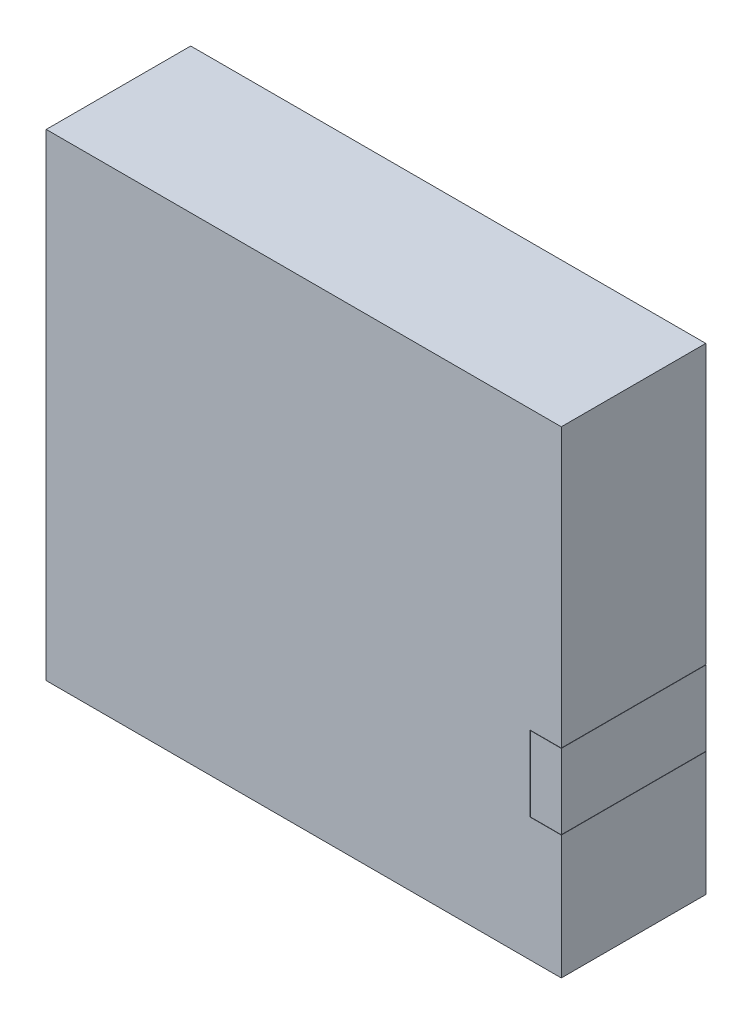
from build123d import *

# Parameters (mm, degrees)
SKETCH_1_W          = 82
SKETCH_1_H          = 76
EXTRUDE_1_DEPTH     = 23
SKETCH_2_W          = 5
SKETCH_2_H          = 12
CUT_EXTRUDE_1_DEPTH = 23
SKETCH_5_W          = 4.9
SKETCH_5_H          = 11.9
EXTRUDE_3_DEPTH     = 23


with BuildPart() as part:
    # 草图1 → 凸台-拉伸1 (new body)
    with BuildSketch(Plane.XY):
        with Locations((-0.551569507, -15.753363229)):
            Rectangle(SKETCH_1_W, SKETCH_1_H)
    extrude(amount=EXTRUDE_1_DEPTH)

    # 草图2 → 切除-拉伸1 (cut)
    with BuildSketch(Plane.XY.offset(23)):
        with Locations((37.948430493, -28.051693566)):
            Rectangle(SKETCH_2_W, SKETCH_2_H)
    extrude(amount=-CUT_EXTRUDE_1_DEPTH, mode=Mode.SUBTRACT)


with BuildPart() as body_2:
    # 草图5 → 凸台-拉伸3 (new body)
    with BuildSketch(Plane.XY.offset(23)):
        with Locations((37.998430493, -28.051693566)):
            Rectangle(SKETCH_5_W, SKETCH_5_H)
    extrude(amount=-EXTRUDE_3_DEPTH)


solid = Compound([part.part, body_2.part])
